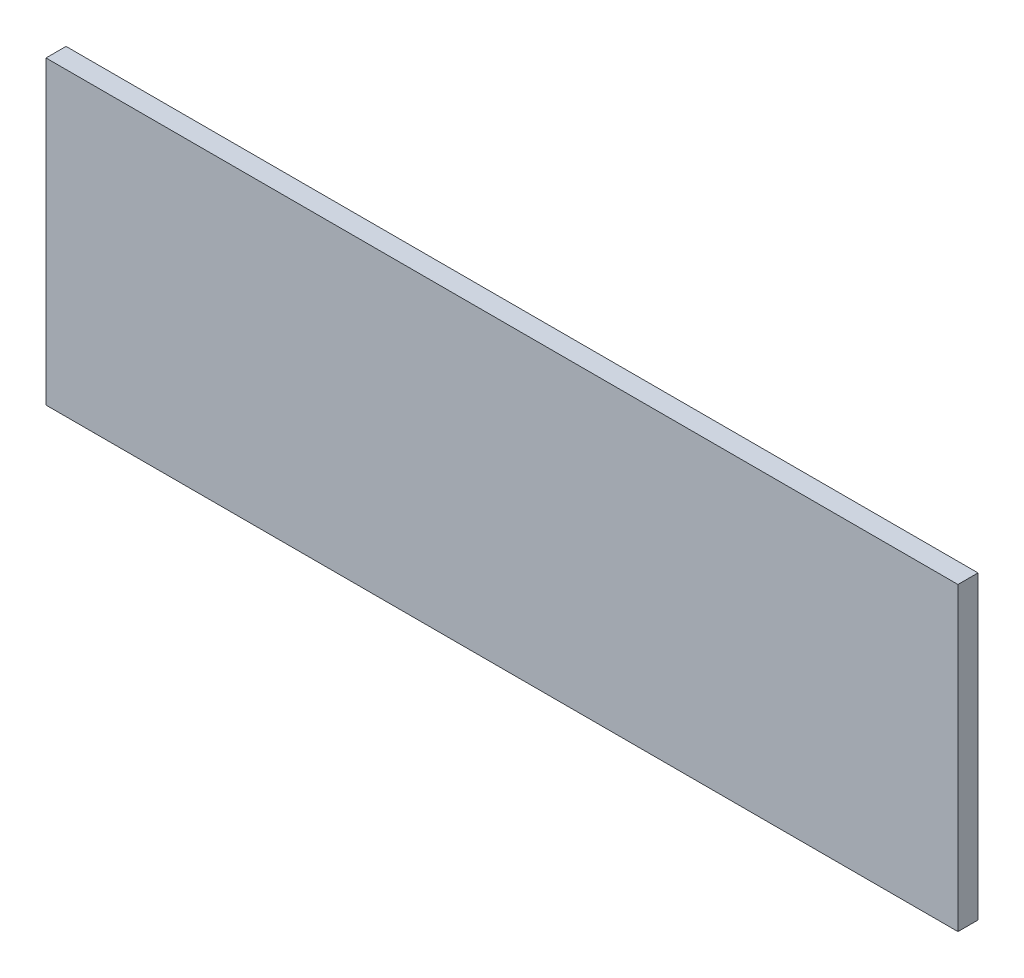
from build123d import *

# Parameters (mm, degrees)
CROQUIS1_W              = 182
CROQUIS1_H              = 60
SALIENTE_EXTRUIR1_DEPTH = 2


with BuildPart() as part:
    # Croquis1 → Saliente-Extruir1 (new, symmetric)
    with BuildSketch(Plane.XY):
        with Locations((91, 30)):
            Rectangle(CROQUIS1_W, CROQUIS1_H)
    extrude(amount=SALIENTE_EXTRUIR1_DEPTH, both=True)


solid = part.part
